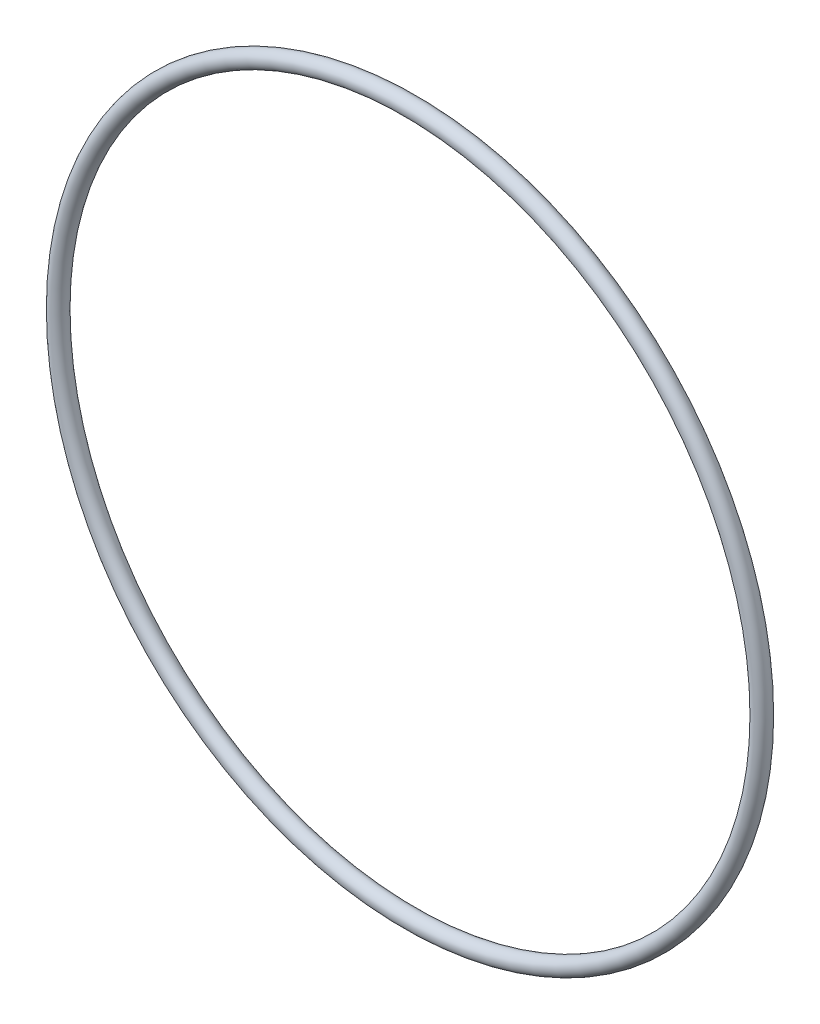
from build123d import *

# Parameters (mm, degrees)
SKETCH1_R = 1.25


with BuildPart() as part:
    # Sketch1 → Revolve1 (revolve)
    with BuildSketch(Plane(origin=(0, 0, 0), x_dir=(0, 0, -1), z_dir=(1, 0, 0)), mode=Mode.PRIVATE) as revolve1_sk:
        with Locations((0, 52.5)):
            Circle(SKETCH1_R)
    revolve(revolve1_sk.sketch.rotate(Axis((0, 0, 2.535396742), (0, 0, -1)), 90), axis=Axis((0, 0, 2.535396742), (0, 0, -1)))


solid = part.part
